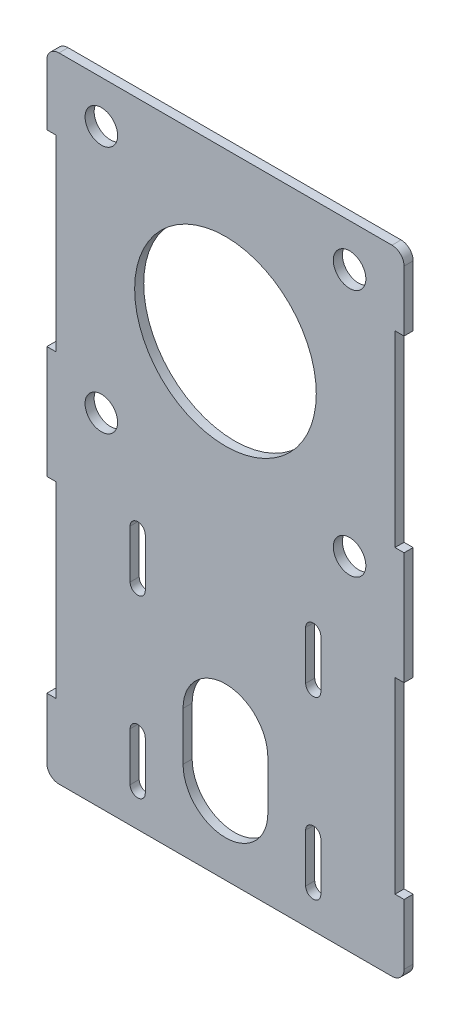
from build123d import *

# Parameters (mm, degrees)
SKETCH1_W          = 187.325
SKETCH1_H          = 332.057083461
EXTRUDE1_DEPTH     = 4.7625
CUT_EXTRUDE1_REACH = 264.098
CUT_EXTRUDE2_REACH = 264.098
SKETCH3_R          = 47.625
SKETCH3_R_2        = 8.5328125
FILLET1_R          = 6.35
CUT_EXTRUDE3_REACH = 264.098
SKETCH4_W          = 4.7625
SKETCH4_H          = 98.425


with BuildPart() as part:
    # Sketch1 → Extrude1 (new body)
    with BuildSketch(Plane.XY):
        with Locations((0, -78.716041731)):
            Rectangle(SKETCH1_W, SKETCH1_H)
    extrude(amount=-EXTRUDE1_DEPTH)

    # Sketch2 → Cut-Extrude1 (cut, up to next)
    with BuildSketch(Plane.XY, mode=Mode.PRIVATE) as cut_extrude1_sk1:
        with BuildLine():
            Line((-22.225, -203.2), (-22.225, -177.8))
            ThreePointArc((-22.225, -177.8), (0, -155.575), (22.225, -177.8))
            Line((22.225, -177.8), (22.225, -203.2))
            ThreePointArc((22.225, -203.2), (0, -225.425), (-22.225, -203.2))
        make_face()
    cut_extrude1_tool1 = extrude(cut_extrude1_sk1.sketch, amount=-CUT_EXTRUDE1_REACH, mode=Mode.PRIVATE) & part.part
    # Sketch2 → Cut-Extrude1 (cut, up to next)
    with BuildSketch(Plane.XY, mode=Mode.PRIVATE) as cut_extrude1_sk2:
        with BuildLine():
            Line((49.99355, -108.9152), (49.99355, -134.3152))
            ThreePointArc((49.99355, -134.3152), (46.0248, -138.28395), (42.05605, -134.3152))
            Line((42.05605, -134.3152), (42.05605, -108.9152))
            ThreePointArc((42.05605, -108.9152), (46.0248, -104.94645), (49.99355, -108.9152))
        make_face()
    cut_extrude1_tool2 = extrude(cut_extrude1_sk2.sketch, amount=-CUT_EXTRUDE1_REACH, mode=Mode.PRIVATE) & part.part
    # Sketch2 → Cut-Extrude1 (cut, up to next)
    with BuildSketch(Plane.XY, mode=Mode.PRIVATE) as cut_extrude1_sk3:
        with BuildLine():
            Line((-42.05605, -108.9152), (-42.05605, -134.3152))
            ThreePointArc((-42.05605, -134.3152), (-46.0248, -138.28395), (-49.99355, -134.3152))
            Line((-49.99355, -134.3152), (-49.99355, -108.9152))
            ThreePointArc((-49.99355, -108.9152), (-46.0248, -104.94645), (-42.05605, -108.9152))
        make_face()
    cut_extrude1_tool3 = extrude(cut_extrude1_sk3.sketch, amount=-CUT_EXTRUDE1_REACH, mode=Mode.PRIVATE) & part.part
    # Sketch2 → Cut-Extrude1 (cut, up to next)
    with BuildSketch(Plane.XY, mode=Mode.PRIVATE) as cut_extrude1_sk4:
        with BuildLine():
            Line((49.99355, -200.9648), (49.99355, -226.3648))
            ThreePointArc((49.99355, -226.3648), (46.0248, -230.33355), (42.05605, -226.3648))
            Line((42.05605, -226.3648), (42.05605, -200.9648))
            ThreePointArc((42.05605, -200.9648), (46.0248, -196.99605), (49.99355, -200.9648))
        make_face()
    cut_extrude1_tool4 = extrude(cut_extrude1_sk4.sketch, amount=-CUT_EXTRUDE1_REACH, mode=Mode.PRIVATE) & part.part
    # Sketch2 → Cut-Extrude1 (cut, up to next)
    with BuildSketch(Plane.XY, mode=Mode.PRIVATE) as cut_extrude1_sk5:
        with BuildLine():
            Line((-42.05605, -200.9648), (-42.05605, -226.3648))
            ThreePointArc((-42.05605, -226.3648), (-46.0248, -230.33355), (-49.99355, -226.3648))
            Line((-49.99355, -226.3648), (-49.99355, -200.9648))
            ThreePointArc((-49.99355, -200.9648), (-46.0248, -196.99605), (-42.05605, -200.9648))
        make_face()
    cut_extrude1_tool5 = extrude(cut_extrude1_sk5.sketch, amount=-CUT_EXTRUDE1_REACH, mode=Mode.PRIVATE) & part.part
    add(cut_extrude1_tool1.solids().sort_by_distance((0, -190.5, 0))[0], mode=Mode.SUBTRACT)
    add(cut_extrude1_tool2.solids().sort_by_distance((46.0248, -121.6152, 0))[0], mode=Mode.SUBTRACT)
    add(cut_extrude1_tool3.solids().sort_by_distance((-46.0248, -121.6152, 0))[0], mode=Mode.SUBTRACT)
    add(cut_extrude1_tool4.solids().sort_by_distance((46.0248, -213.6648, 0))[0], mode=Mode.SUBTRACT)
    add(cut_extrude1_tool5.solids().sort_by_distance((-46.0248, -213.6648, 0))[0], mode=Mode.SUBTRACT)

    # Sketch3 → Cut-Extrude2 (cut, up to next)
    with BuildSketch(Plane(origin=(0, 0, 0), x_dir=(-1, 0, 0), z_dir=(0, 0, -1)), mode=Mode.PRIVATE) as cut_extrude2_sk1:
        Circle(SKETCH3_R)
    cut_extrude2_tool1 = extrude(cut_extrude2_sk1.sketch, amount=CUT_EXTRUDE2_REACH, mode=Mode.PRIVATE) & part.part
    # Sketch3 → Cut-Extrude2 (cut, up to next)
    with BuildSketch(Plane(origin=(0, 0, 0), x_dir=(-1, 0, 0), z_dir=(0, 0, -1)), mode=Mode.PRIVATE) as cut_extrude2_sk2:
        with Locations((65.0875, 65.0875)):
            Circle(SKETCH3_R_2)
    cut_extrude2_tool2 = extrude(cut_extrude2_sk2.sketch, amount=CUT_EXTRUDE2_REACH, mode=Mode.PRIVATE) & part.part
    # Sketch3 → Cut-Extrude2 (cut, up to next)
    with BuildSketch(Plane(origin=(0, 0, 0), x_dir=(-1, 0, 0), z_dir=(0, 0, -1)), mode=Mode.PRIVATE) as cut_extrude2_sk3:
        with Locations((-65.0875, 65.0875)):
            Circle(SKETCH3_R_2)
    cut_extrude2_tool3 = extrude(cut_extrude2_sk3.sketch, amount=CUT_EXTRUDE2_REACH, mode=Mode.PRIVATE) & part.part
    # Sketch3 → Cut-Extrude2 (cut, up to next)
    with BuildSketch(Plane(origin=(0, 0, 0), x_dir=(-1, 0, 0), z_dir=(0, 0, -1)), mode=Mode.PRIVATE) as cut_extrude2_sk4:
        with Locations((-65.0875, -65.0875)):
            Circle(SKETCH3_R_2)
    cut_extrude2_tool4 = extrude(cut_extrude2_sk4.sketch, amount=CUT_EXTRUDE2_REACH, mode=Mode.PRIVATE) & part.part
    # Sketch3 → Cut-Extrude2 (cut, up to next)
    with BuildSketch(Plane(origin=(0, 0, 0), x_dir=(-1, 0, 0), z_dir=(0, 0, -1)), mode=Mode.PRIVATE) as cut_extrude2_sk5:
        with Locations((65.0875, -65.0875)):
            Circle(SKETCH3_R_2)
    cut_extrude2_tool5 = extrude(cut_extrude2_sk5.sketch, amount=CUT_EXTRUDE2_REACH, mode=Mode.PRIVATE) & part.part
    add(cut_extrude2_tool1.solids().sort_by_distance((0, 0, 0))[0], mode=Mode.SUBTRACT)
    add(cut_extrude2_tool2.solids().sort_by_distance((-65.0875, 65.0875, 0))[0], mode=Mode.SUBTRACT)
    add(cut_extrude2_tool3.solids().sort_by_distance((65.0875, 65.0875, 0))[0], mode=Mode.SUBTRACT)
    add(cut_extrude2_tool4.solids().sort_by_distance((65.0875, -65.0875, 0))[0], mode=Mode.SUBTRACT)
    add(cut_extrude2_tool5.solids().sort_by_distance((-65.0875, -65.0875, 0))[0], mode=Mode.SUBTRACT)

    # Fillet1
    fillet1_edges = [part.edges().sort_by_distance(p)[0] for p in [
        (93.6625, -244.744583461, -2.38125),
        (-93.6625, -244.744583461, -2.38125),
        (-93.6625, 87.3125, -2.38125),
        (93.6625, 87.3125, -2.38125),
    ]]
    fillet(fillet1_edges, radius=FILLET1_R)

    # Sketch4 → Cut-Extrude3 (cut, up to next)
    with BuildSketch(Plane(origin=(0, 0, -4.7625), x_dir=(-1, 0, 0), z_dir=(0, 0, -1)), mode=Mode.PRIVATE) as cut_extrude3_sk1:
        with Locations((-91.28125, 0)):
            Rectangle(SKETCH4_W, SKETCH4_H)
    cut_extrude3_tool1 = extrude(cut_extrude3_sk1.sketch, amount=-CUT_EXTRUDE3_REACH, mode=Mode.PRIVATE) & part.part
    # Sketch4 → Cut-Extrude3 (cut, up to next)
    with BuildSketch(Plane(origin=(0, 0, -4.7625), x_dir=(-1, 0, 0), z_dir=(0, 0, -1)), mode=Mode.PRIVATE) as cut_extrude3_sk2:
        with Locations((-91.28125, -157.432083461)):
            Rectangle(SKETCH4_W, SKETCH4_H)
    cut_extrude3_tool2 = extrude(cut_extrude3_sk2.sketch, amount=-CUT_EXTRUDE3_REACH, mode=Mode.PRIVATE) & part.part
    cut_extrude3_1 = cut_extrude3_tool1.solids().sort_by_distance((91.28125, 0, -4.7625))[0]
    add(cut_extrude3_1, mode=Mode.SUBTRACT)
    cut_extrude3_2 = cut_extrude3_tool2.solids().sort_by_distance((91.28125, -157.432083, -4.7625))[0]
    add(cut_extrude3_2, mode=Mode.SUBTRACT)
    cut_extrude3 = cut_extrude3_1 + cut_extrude3_2  # Cut-Extrude3 as one shape, for the pattern or mirror that repeats it

    # Mirror1: Cut-Extrude3 across plane
    add(cut_extrude3.mirror(Plane(origin=(0, 0, 0), x_dir=(0, 0, 1), z_dir=(1, 0, 0))), mode=Mode.SUBTRACT)


solid = part.part
